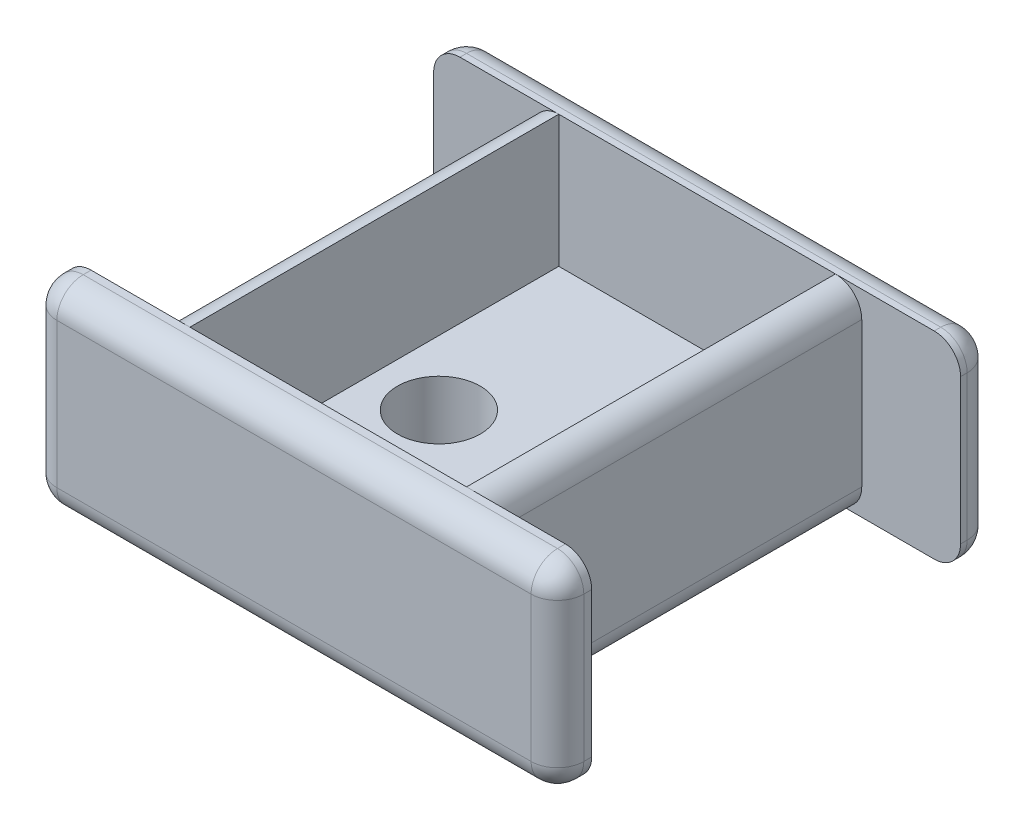
from build123d import *

# Parameters (mm, degrees)
BOSS_EXTRUDE1_DEPTH = 19.05
SKETCH4_R           = 4.064
SKETCH4_R_2         = 4.0005
CUT_EXTRUDE3_DEPTH  = 38.1
FILLET8_R           = 2.54
FILLET9_R           = 2.54
SKETCH9_W           = 26.67
SKETCH9_H           = 35.56
CUT_EXTRUDE6_DEPTH  = 12.7
BOSS_EXTRUDE2_DEPTH = 0.254


with BuildPart() as part:
    # Sketch1 → Boss-Extrude1 (new body)
    with BuildSketch(Plane(origin=(0, 0, 0), x_dir=(1, 0, 0), z_dir=(0, 1, 0))):
        Polygon((25.4, 20.955), (-25.4, 20.955), (-25.4, 17.78), (-15.875, 17.78), (-15.875, -17.78), (-25.4, -17.78), (-25.4, -21.082), (25.4, -21.082), (25.4, -17.78), (15.875, -17.78), (15.875, 17.78), (25.4, 17.78), align=None)
    extrude(amount=BOSS_EXTRUDE1_DEPTH)

    # Sketch4 → Cut-Extrude3 (cut)
    with BuildSketch(Plane(origin=(0, 19.05, 0), x_dir=(1, 0, 0), z_dir=(0, 1, 0))):
        with Locations(Location((6.985, 0, 0), (0, 0, 270))):
            Circle(SKETCH4_R)
        with Locations(Location((-7.112, 0, 0), (0, 0, 270))):
            Circle(SKETCH4_R_2)
    extrude(amount=-CUT_EXTRUDE3_DEPTH, mode=Mode.SUBTRACT)

    # Fillet8
    fillet8_edges = [part.edges().sort_by_distance(p)[0] for p in [
        (15.875, 0, 0),
        (0, 0, 21.082),
        (-15.875, 0, 0),
        (0, 0, -20.955),
        (-15.875, 19.05, 0),
        (0, 19.05, 21.082),
        (15.875, 19.05, 0),
        (0, 19.05, -20.955),
    ]]
    fillet(fillet8_edges, radius=FILLET8_R)

    # Fillet9
    fillet9_edges = [part.edges().sort_by_distance(p)[0] for p in [
        (-25.4, 0, 18.161),
        (25.4, 0, -18.0975),
        (-25.4, 19.05, 18.161),
        (25.4, 19.05, -18.0975),
        (-25.4, 9.525, -20.955),
        (25.4, 9.525, -20.955),
        (-25.4, 0, -18.0975),
        (-25.4, 19.05, -18.0975),
        (-25.4, 18.306051224, -20.211051224),
        (-25.4, 0.743948776, -20.211051224),
        (25.4, 0, 18.161),
        (25.4, 18.306051224, -20.211051224),
        (25.4, 0.743948776, -20.211051224),
        (25.4, 9.525, 21.082),
        (-25.4, 9.525, 21.082),
        (25.4, 19.05, 18.161),
        (25.4, 18.306051224, 20.338051224),
        (25.4, 0.743948776, 20.338051224),
        (-25.4, 18.306051224, 20.338051224),
        (-25.4, 0.743948776, 20.338051224),
    ]]
    fillet(fillet9_edges, radius=FILLET9_R)

    # Sketch9 → Cut-Extrude6 (cut)
    with BuildSketch(Plane(origin=(0, 19.05, 0), x_dir=(1, 0, 0), z_dir=(0, 1, 0))):
        Rectangle(SKETCH9_W, SKETCH9_H)
    extrude(amount=-CUT_EXTRUDE6_DEPTH, mode=Mode.SUBTRACT)

    # Sketch10 → Boss-Extrude2 (add)
    # profile 1 of 6: a face of its own
    with BuildSketch(Plane.ZY.offset(15.875)):
        with BuildLine():
            Line((-12.428218361, 9.878456619), (-12.428218361, 8.364943106))
            Line((-12.428218361, 8.364943106), (-12.208729341, 8.364943106))
            add(Edge.make_bspline(
                [(-12.208729341, 8.364943106), (-12.180616558, 8.365690265), (-12.125673568, 8.367150495), (-12.045658699, 8.377427278), (-11.970309821, 8.39514739), (-11.899982609, 8.420349213), (-11.834121009, 8.452287921), (-11.773429787, 8.491629768), (-11.717332866, 8.537958281), (-11.665938638, 8.591911368), (-11.618331766, 8.653794358), (-11.574984177, 8.724337959), (-11.534888519, 8.803496713), (-11.49830777, 8.891239191), (-11.464954173, 8.987736915), (-11.43597942, 9.092802925), (-11.408802352, 9.206306107), (-11.394885674, 9.285428621), (-11.387677821, 9.326408477)],
                knots=[0, 0, 0, 0, 0.962867631, 1.881806797, 2.75778512, 3.609196864, 4.435656485, 5.259527481, 6.080628282, 6.92211412, 7.806505393, 8.7501395, 9.753953683, 10.843121875, 12.003935138, 13.24877583, 14.575060796, 16, 16, 16, 16], degree=3))
            Line((-11.387677821, 9.326408477), (-11.300473429, 9.326408477))
            Line((-11.300473429, 9.326408477), (-11.300473429, 7.318490403))
            Line((-11.300473429, 7.318490403), (-11.392850963, 7.318490403))
            add(Edge.make_bspline(
                [(-11.392850963, 7.318490403), (-11.39934008, 7.359704496), (-11.411706859, 7.438249171), (-11.435525947, 7.548337221), (-11.460098596, 7.645587806), (-11.488669104, 7.730405829), (-11.520332587, 7.807052079), (-11.556424835, 7.878255468), (-11.598518009, 7.945075297), (-11.630935932, 7.986097142), (-11.647073936, 8.006518275)],
                knots=[0, 0, 0, 0, 1.347106059, 2.567277364, 3.636273155, 4.584709308, 5.454914307, 6.312371043, 7.159879461, 8, 8, 8, 8], degree=3))
            add(Edge.make_bspline(
                [(-11.647073936, 8.006518275), (-11.665269253, 8.027726126), (-11.70111357, 8.069505057), (-11.763799725, 8.122939975), (-11.831002075, 8.16938286), (-11.905054217, 8.206337121), (-11.984666097, 8.235214658), (-12.070123871, 8.256005672), (-12.161363743, 8.267532579), (-12.223971322, 8.269394963), (-12.256026638, 8.270348511)],
                knots=[0, 0, 0, 0, 0.973810499, 1.918382085, 2.864985682, 3.818434723, 4.797467574, 5.814959202, 6.881250899, 8, 8, 8, 8], degree=3))
            Line((-12.256026638, 8.270348511), (-12.428218361, 8.270348511))
            Line((-12.428218361, 8.270348511), (-12.428218361, 7.205420302))
            add(Edge.make_bspline(
                [(-12.428218361, 7.205420302), (-12.427873479, 7.179290217), (-12.427204981, 7.128641254), (-12.419767609, 7.055234451), (-12.407248462, 6.987042322), (-12.390202895, 6.924027973), (-12.369430061, 6.865753484), (-12.341274281, 6.813719758), (-12.309705217, 6.766148121), (-12.273199639, 6.723451461), (-12.231408506, 6.68623578), (-12.184450142, 6.65420593), (-12.132109903, 6.627730262), (-12.075033876, 6.605336217), (-12.012482597, 6.588708937), (-11.94532025, 6.576128196), (-11.872891507, 6.568628643), (-11.822978929, 6.567981439), (-11.797095051, 6.567645808)],
                knots=[0, 0, 0, 0, 1.214734356, 2.354567063, 3.426283889, 4.434989608, 5.388249835, 6.29523612, 7.178473649, 8.039518568, 8.899496045, 9.773248569, 10.674938643, 11.621568376, 12.619221065, 13.679675458, 14.796716187, 16, 16, 16, 16], degree=3))
            Line((-11.797095051, 6.567645808), (-11.574649949, 6.567645808))
            Line((-11.574649949, 6.567645808), (-11.574649949, 6.473051214))
            Line((-11.574649949, 6.473051214), (-13.906258902, 6.473051214))
            Line((-13.906258902, 6.473051214), (-13.906258902, 6.567645808))
            Line((-13.906258902, 6.567645808), (-13.81905451, 6.567645808))
            add(Edge.make_bspline(
                [(-13.81905451, 6.567645808), (-13.793173369, 6.568006712), (-13.742775841, 6.568709487), (-13.66982425, 6.575978311), (-13.601975281, 6.588838081), (-13.539112378, 6.605201611), (-13.481801021, 6.627706466), (-13.429388114, 6.654429138), (-13.381870839, 6.685991946), (-13.339975425, 6.723456967), (-13.303762429, 6.766078043), (-13.27144685, 6.813193171), (-13.244185502, 6.865462277), (-13.222781986, 6.923447654), (-13.205984384, 6.986321766), (-13.193476154, 7.054250407), (-13.185954816, 7.127406667), (-13.185309605, 7.177811597), (-13.184975118, 7.203942261)],
                knots=[0, 0, 0, 0, 1.201641854, 2.339919186, 3.39892652, 4.406255795, 5.35159379, 6.25205345, 7.134085744, 7.992889725, 8.852759693, 9.725319925, 10.641197808, 11.582443261, 12.589772536, 13.660026934, 14.786923228, 16, 16, 16, 16], degree=3))
            Line((-13.184975118, 7.203942261), (-13.184975118, 9.242160166))
            add(Edge.make_bspline(
                [(-13.184975118, 9.242160166), (-13.185342493, 9.268285674), (-13.186058036, 9.319170899), (-13.193243266, 9.392883187), (-13.206343648, 9.46108695), (-13.221537637, 9.524467047), (-13.244604502, 9.581724084), (-13.270521186, 9.634591019), (-13.302888777, 9.681391245), (-13.339228301, 9.723451269), (-13.381261436, 9.759897221), (-13.42819623, 9.791735284), (-13.479970566, 9.819453083), (-13.537841292, 9.840612349), (-13.600689392, 9.857454106), (-13.668864901, 9.870015399), (-13.742276501, 9.877440606), (-13.792924779, 9.878110841), (-13.81905451, 9.878456619)],
                knots=[0, 0, 0, 0, 1.211797835, 2.360245289, 3.429371327, 4.43271442, 5.377055753, 6.286743398, 7.158383697, 8.008714094, 8.859044491, 9.730684789, 10.635478509, 11.575731615, 12.581998871, 13.651124909, 14.788202165, 16, 16, 16, 16], degree=3))
            Line((-13.81905451, 9.878456619), (-13.906258902, 9.878456619))
            Line((-13.906258902, 9.878456619), (-13.906258902, 9.973051214))
            Line((-13.906258902, 9.973051214), (-10.07369978, 9.973051214))
            Line((-10.07369978, 9.973051214), (-10.07369978, 8.462493781))
            Line((-10.07369978, 8.462493781), (-10.15573103, 8.462493781))
            add(Edge.make_bspline(
                [(-10.15573103, 8.462493781), (-10.16815866, 8.524958031), (-10.192002131, 8.644801044), (-10.229503377, 8.78891403), (-10.259534232, 8.89335961), (-10.280445786, 8.961003624), (-10.30253496, 9.018620191), (-10.318405844, 9.053285184), (-10.325705693, 9.069229423)],
                knots=[0, 0, 0, 0, 1.815178137, 3.482574705, 4.242659767, 4.913343155, 5.500189807, 6, 6, 6, 6], degree=3))
            add(Edge.make_bspline(
                [(-10.325705693, 9.069229423), (-10.346997579, 9.113642936), (-10.388492147, 9.200197952), (-10.459793096, 9.32160666), (-10.540454033, 9.428866634), (-10.626249156, 9.525419995), (-10.720267531, 9.609592223), (-10.821892508, 9.682603282), (-10.932223194, 9.743367399), (-11.050406574, 9.79302267), (-11.17672221, 9.83151415), (-11.311395658, 9.858348987), (-11.454209315, 9.876092522), (-11.552423531, 9.877655831), (-11.60273272, 9.878456619)],
                knots=[0, 0, 0, 0, 1.098226841, 2.140272995, 3.133547444, 4.086628967, 5.01643607, 5.941818129, 6.871349284, 7.819239113, 8.795890279, 9.810821449, 10.878616558, 12, 12, 12, 12], degree=3))
            Line((-11.60273272, 9.878456619), (-12.428218361, 9.878456619))
        make_face()
    # profile 2 of 6: a face of its own
    with BuildSketch(Plane.ZY.offset(15.875)):
        with BuildLine():
            Line((-9.656153328, 9.973051214), (-7.224776638, 9.973051214))
            Line((-7.224776638, 9.973051214), (-7.224776638, 9.878456619))
            Line((-7.224776638, 9.878456619), (-7.498214138, 9.878456619))
            add(Edge.make_bspline(
                [(-7.498214138, 9.878456619), (-7.523604398, 9.878102746), (-7.573022414, 9.87741399), (-7.644723588, 9.870034668), (-7.711403067, 9.857413564), (-7.773171901, 9.840697366), (-7.829793136, 9.818578977), (-7.881067824, 9.790808976), (-7.928128014, 9.759200366), (-7.969894888, 9.721902653), (-8.006313743, 9.679179775), (-8.038325838, 9.631713892), (-8.06499476, 9.578792199), (-8.086250123, 9.520648235), (-8.103160652, 9.457566517), (-8.115784771, 9.389154752), (-8.123111909, 9.315484931), (-8.123807287, 9.264593671), (-8.124164307, 9.238465065)],
                knots=[0, 0, 0, 0, 1.183666125, 2.3038138, 3.355928178, 4.345281173, 5.283849776, 6.183219152, 7.059401939, 7.921771364, 8.785211201, 9.670905375, 10.585333788, 11.541245421, 12.552756763, 13.62745447, 14.781886972, 16, 16, 16, 16], degree=3))
            Line((-8.124164307, 9.238465065), (-8.124164307, 7.452992092))
            add(Edge.make_bspline(
                [(-8.124164307, 7.452992092), (-8.122508381, 7.403852208), (-8.119288557, 7.308303455), (-8.09299675, 7.170442357), (-8.049939934, 7.043225226), (-7.990167609, 6.926725372), (-7.911903741, 6.823415476), (-7.819811092, 6.731427526), (-7.711391854, 6.653360637), (-7.589071848, 6.587431266), (-7.452530739, 6.536065184), (-7.303471153, 6.499351019), (-7.142438544, 6.476955432), (-7.03098174, 6.474379485), (-6.973509747, 6.473051214)],
                knots=[0, 0, 0, 0, 1.034620493, 2.01174059, 2.943918765, 3.856135388, 4.757062871, 5.663474232, 6.588357472, 7.561278922, 8.582945766, 9.652823849, 10.789693508, 12, 12, 12, 12], degree=3))
            add(Edge.make_bspline(
                [(-6.973509747, 6.473051214), (-6.922228717, 6.474242328), (-6.820861165, 6.476596811), (-6.671717808, 6.493589883), (-6.527981799, 6.522830956), (-6.390828861, 6.562011965), (-6.262777946, 6.611770462), (-6.146976331, 6.670522707), (-6.044818485, 6.738513292), (-5.98654541, 6.792040934), (-5.958095895, 6.81817368)],
                knots=[0, 0, 0, 0, 1.120644207, 2.215184851, 3.275247005, 4.323140333, 5.328904462, 6.272763422, 7.156745323, 8, 8, 8, 8], degree=3))
            add(Edge.make_bspline(
                [(-5.958095895, 6.81817368), (-5.93453439, 6.844503413), (-5.887165344, 6.897437823), (-5.827601297, 6.986872942), (-5.776992926, 7.083796916), (-5.735739638, 7.188093239), (-5.703799525, 7.300262995), (-5.681419144, 7.420004096), (-5.666865154, 7.547475672), (-5.665437084, 7.634995806), (-5.664704848, 7.679871315)],
                knots=[0, 0, 0, 0, 0.907850671, 1.825181402, 2.754749982, 3.716017578, 4.704708414, 5.749775835, 6.846208846, 8, 8, 8, 8], degree=3))
            Line((-5.664704848, 7.679871315), (-5.664704848, 8.939161856))
            add(Edge.make_bspline(
                [(-5.664704848, 8.939161856), (-5.665561141, 8.987493258), (-5.667209174, 9.080512446), (-5.683534308, 9.214179293), (-5.71049035, 9.335855256), (-5.747995485, 9.445419985), (-5.796232733, 9.543379433), (-5.856468008, 9.628654361), (-5.926934611, 9.702932034), (-5.982242913, 9.741151728), (-6.009827314, 9.760213376)],
                knots=[0, 0, 0, 0, 1.245753361, 2.39759167, 3.465474722, 4.453792469, 5.376996215, 6.270462566, 7.137412406, 8, 8, 8, 8], degree=3))
            add(Edge.make_bspline(
                [(-6.009827314, 9.760213376), (-6.042740413, 9.779185873), (-6.108051792, 9.816834103), (-6.199819529, 9.846098779), (-6.280498449, 9.86049873), (-6.352823333, 9.868966029), (-6.437117787, 9.875740235), (-6.497319411, 9.877513103), (-6.529358564, 9.878456619)],
                knots=[0, 0, 0, 0, 1.263201928, 2.506645158, 3.182866477, 3.993341604, 4.932061436, 6, 6, 6, 6], degree=3))
            Line((-6.529358564, 9.878456619), (-6.529358564, 9.973051214))
            Line((-6.529358564, 9.973051214), (-4.839219206, 9.973051214))
            Line((-4.839219206, 9.973051214), (-4.839219206, 9.878456619))
            add(Edge.make_bspline(
                [(-4.839219206, 9.878456619), (-4.864125201, 9.876225863), (-4.911345879, 9.871996446), (-4.977953882, 9.862435697), (-5.03651438, 9.850868266), (-5.105041625, 9.832025402), (-5.187460207, 9.796705011), (-5.246820833, 9.756393995), (-5.278197247, 9.735086687)],
                knots=[0, 0, 0, 0, 0.959871685, 1.819874719, 2.582181741, 3.249919705, 4.546382294, 6, 6, 6, 6], degree=3))
            add(Edge.make_bspline(
                [(-5.278197247, 9.735086687), (-5.300915138, 9.71595603), (-5.346368149, 9.67768021), (-5.405301727, 9.609168491), (-5.45554419, 9.53170047), (-5.497916689, 9.4457621), (-5.53013796, 9.351009655), (-5.553764889, 9.248545956), (-5.56792733, 9.137861972), (-5.56936729, 9.061389125), (-5.570110253, 9.021932126)],
                knots=[0, 0, 0, 0, 0.891296972, 1.783269844, 2.703003498, 3.659672428, 4.65452199, 5.703075205, 6.814876632, 8, 8, 8, 8], degree=3))
            Line((-5.570110253, 9.021932126), (-5.570110253, 7.619271653))
            add(Edge.make_bspline(
                [(-5.570110253, 7.619271653), (-5.571181376, 7.573912582), (-5.573259127, 7.485925563), (-5.58708609, 7.35774874), (-5.611563393, 7.238144585), (-5.644583043, 7.126000571), (-5.688112713, 7.022312652), (-5.741825835, 6.927000056), (-5.804532009, 6.839385589), (-5.854205827, 6.788278207), (-5.879020726, 6.76274716)],
                knots=[0, 0, 0, 0, 1.162756437, 2.255501963, 3.299502036, 4.288422551, 5.247788254, 6.175176988, 7.088397021, 8, 8, 8, 8], degree=3))
            add(Edge.make_bspline(
                [(-5.879020726, 6.76274716), (-5.906335252, 6.737239544), (-5.959964985, 6.687157524), (-6.047760274, 6.624138426), (-6.137331428, 6.570240819), (-6.200384542, 6.543771096), (-6.231533395, 6.530694795)],
                knots=[0, 0, 0, 0, 1.054621979, 2.070659909, 3.046887177, 4, 4, 4, 4], degree=3))
            add(Edge.make_bspline(
                [(-6.231533395, 6.530694795), (-6.265153692, 6.518480726), (-6.333513973, 6.493645813), (-6.440254097, 6.46312609), (-6.551309914, 6.43612161), (-6.667492154, 6.416154847), (-6.787901557, 6.398559471), (-6.913486011, 6.387359607), (-7.043614695, 6.379451002), (-7.131893641, 6.378791602), (-7.176740321, 6.378456619)],
                knots=[0, 0, 0, 0, 0.891566565, 1.812825789, 2.766219052, 3.739639371, 4.75065812, 5.799366071, 6.88205363, 8, 8, 8, 8], degree=3))
            add(Edge.make_bspline(
                [(-7.176740321, 6.378456619), (-7.242786307, 6.379472639), (-7.371846056, 6.381458033), (-7.560658613, 6.396269394), (-7.740124577, 6.421236786), (-7.909358158, 6.456181073), (-8.06666209, 6.501114901), (-8.210724946, 6.554065638), (-8.341174421, 6.615428368), (-8.419494268, 6.6653722), (-8.457462449, 6.689584153)],
                knots=[0, 0, 0, 0, 1.185940103, 2.317432746, 3.398467779, 4.43782573, 5.41793926, 6.333323014, 7.192022255, 8, 8, 8, 8], degree=3))
            add(Edge.make_bspline(
                [(-8.457462449, 6.689584153), (-8.491090041, 6.713684858), (-8.557175992, 6.761048285), (-8.644203109, 6.84434083), (-8.717014539, 6.936266879), (-8.777791576, 7.034899263), (-8.823526917, 7.141953055), (-8.857058188, 7.255976178), (-8.877355584, 7.37812245), (-8.879711814, 7.462274512), (-8.880921064, 7.505462531)],
                knots=[0, 0, 0, 0, 1.032984291, 2.030051666, 2.998193363, 3.956835243, 4.916326676, 5.898092387, 6.921271509, 8, 8, 8, 8], degree=3))
            Line((-8.880921064, 7.505462531), (-8.880921064, 9.238465065))
            add(Edge.make_bspline(
                [(-8.880921064, 9.238465065), (-8.881262263, 9.264349693), (-8.881923436, 9.31450885), (-8.889405017, 9.387170097), (-8.901819532, 9.454957992), (-8.919617545, 9.517712994), (-8.941518831, 9.575905386), (-8.9690724, 9.628583437), (-9.001163971, 9.676504061), (-9.037918231, 9.719716571), (-9.080934915, 9.756873955), (-9.128198299, 9.789501082), (-9.180672341, 9.816942542), (-9.237783001, 9.839911751), (-9.299911096, 9.857784324), (-9.367169201, 9.868744393), (-9.438887473, 9.877794912), (-9.488609027, 9.878231417), (-9.514261436, 9.878456619)],
                knots=[0, 0, 0, 0, 1.202317824, 2.329848042, 3.389451109, 4.400397054, 5.356940965, 6.273334065, 7.155862536, 8.03235821, 8.900216767, 9.78917931, 10.695437472, 11.645522352, 12.645457828, 13.691747676, 14.809123437, 16, 16, 16, 16], degree=3))
            Line((-9.514261436, 9.878456619), (-9.656153328, 9.878456619))
            Line((-9.656153328, 9.878456619), (-9.656153328, 9.973051214))
        make_face()
    # profile 3 of 6: a face of its own
    with BuildSketch(Plane.ZY.offset(15.875)):
        with BuildLine():
            Line((-4.60273272, 9.973051214), (-0.491562956, 9.973051214))
            Line((-0.491562956, 9.973051214), (-0.491562956, 8.194229423))
            Line((-0.491562956, 8.194229423), (-0.571377145, 8.189056281))
            add(Edge.make_bspline(
                [(-0.571377145, 8.189056281), (-0.577394616, 8.243830212), (-0.589233865, 8.3515968), (-0.617681752, 8.509795506), (-0.654387198, 8.662161979), (-0.700271387, 8.808489626), (-0.754374647, 8.949052765), (-0.817245715, 9.083665282), (-0.888714791, 9.212719661), (-0.943257229, 9.294011532), (-0.970448091, 9.3345377)],
                knots=[0, 0, 0, 0, 1.077639742, 2.12023413, 3.141712916, 4.141502564, 5.117814788, 6.085755003, 7.045697765, 8, 8, 8, 8], degree=3))
            add(Edge.make_bspline(
                [(-0.970448091, 9.3345377), (-1.004036276, 9.377924379), (-1.069320184, 9.462253199), (-1.180169051, 9.573287671), (-1.296763202, 9.667841822), (-1.421002553, 9.744801568), (-1.551565251, 9.805516868), (-1.689728229, 9.847140934), (-1.834025091, 9.874417691), (-1.932772098, 9.87709656), (-1.982905861, 9.878456619)],
                knots=[0, 0, 0, 0, 1.100109691, 2.138235824, 3.140287537, 4.105980005, 5.063694346, 6.020604662, 6.995062822, 8, 8, 8, 8], degree=3))
            Line((-1.982905861, 9.878456619), (-2.164704848, 9.878456619))
            Line((-2.164704848, 9.878456619), (-2.164704848, 7.203942261))
            add(Edge.make_bspline(
                [(-2.164704848, 7.203942261), (-2.164350489, 7.178305947), (-2.16366062, 7.128396992), (-2.156282853, 7.055958403), (-2.143649063, 6.988548186), (-2.126974807, 6.926027108), (-2.104640528, 6.868535018), (-2.077234021, 6.816111408), (-2.045526652, 6.767851413), (-2.007418145, 6.726149352), (-1.965484634, 6.688165244), (-1.918096323, 6.655952857), (-1.866046468, 6.628429606), (-1.808964668, 6.606171449), (-1.74711553, 6.588572607), (-1.680077528, 6.576118072), (-1.608393493, 6.568674677), (-1.558973046, 6.567995011), (-1.533581537, 6.567645808)],
                knots=[0, 0, 0, 0, 1.196207752, 2.328785576, 3.39313216, 4.394446538, 5.344550691, 6.265046201, 7.151525482, 8.030893351, 8.894027207, 9.786969363, 10.697284563, 11.636685143, 12.641097023, 13.694144027, 14.815284637, 16, 16, 16, 16], degree=3))
            Line((-1.533581537, 6.567645808), (-1.007399105, 6.567645808))
            Line((-1.007399105, 6.567645808), (-1.007399105, 6.473051214))
            Line((-1.007399105, 6.473051214), (-4.076550287, 6.473051214))
            Line((-4.076550287, 6.473051214), (-4.076550287, 6.567645808))
            Line((-4.076550287, 6.567645808), (-3.554801976, 6.567645808))
            add(Edge.make_bspline(
                [(-3.554801976, 6.567645808), (-3.529163514, 6.567986739), (-3.479495513, 6.568647205), (-3.407570072, 6.576126502), (-3.340518198, 6.588543371), (-3.278496291, 6.60633579), (-3.221044122, 6.628255952), (-3.168770402, 6.655923367), (-3.121435242, 6.688445783), (-3.078726873, 6.725637743), (-3.041463537, 6.768153413), (-3.00963644, 6.816068969), (-2.982219159, 6.868531385), (-2.96013943, 6.926151654), (-2.942263776, 6.988409242), (-2.929961288, 7.055979928), (-2.922484602, 7.12839111), (-2.921808759, 7.178303951), (-2.921461605, 7.203942261)],
                knots=[0, 0, 0, 0, 1.194246268, 2.313548484, 3.364868753, 4.367633646, 5.316179863, 6.225002373, 7.116480325, 7.986794574, 8.857108824, 9.742134499, 10.661120625, 11.609666842, 12.612431735, 13.675033055, 14.805753732, 16, 16, 16, 16], degree=3))
            Line((-2.921461605, 7.203942261), (-2.921461605, 9.878456619))
            Line((-2.921461605, 9.878456619), (-3.146123767, 9.878456619))
            add(Edge.make_bspline(
                [(-3.146123767, 9.878456619), (-3.197012616, 9.876956601), (-3.297138111, 9.874005265), (-3.443156149, 9.844552575), (-3.58184127, 9.798747495), (-3.7135193, 9.734402959), (-3.83756068, 9.651068604), (-3.953043252, 9.548154255), (-4.062992066, 9.429105785), (-4.126136207, 9.338321949), (-4.158581537, 9.291674525)],
                knots=[0, 0, 0, 0, 0.997412868, 1.962442805, 2.910127415, 3.856973432, 4.828914921, 5.832457869, 6.886252656, 8, 8, 8, 8], degree=3))
            add(Edge.make_bspline(
                [(-4.158581537, 9.291674525), (-4.189624817, 9.241973769), (-4.25297096, 9.140555646), (-4.331128055, 8.974494896), (-4.399045212, 8.79541151), (-4.433086212, 8.669509903), (-4.450494544, 8.605124693)],
                knots=[0, 0, 0, 0, 0.93749145, 1.913021675, 2.932733735, 4, 4, 4, 4], degree=3))
            add(Edge.make_bspline(
                [(-4.450494544, 8.605124693), (-4.456119275, 8.579792322), (-4.468627379, 8.523458975), (-4.484255892, 8.429427491), (-4.500530485, 8.317816617), (-4.510293766, 8.237363946), (-4.515528328, 8.194229423)],
                knots=[0, 0, 0, 0, 0.748052937, 1.663497098, 2.747289114, 4, 4, 4, 4], degree=3))
            Line((-4.515528328, 8.194229423), (-4.60273272, 8.194229423))
            Line((-4.60273272, 8.194229423), (-4.60273272, 9.973051214))
        make_face()
    # profile 4 of 6: a face of its own
    with BuildSketch(Plane.ZY.offset(15.875)):
        with BuildLine():
            Line((-0.054801976, 9.973051214), (2.376574713, 9.973051214))
            Line((2.376574713, 9.973051214), (2.376574713, 9.878456619))
            Line((2.376574713, 9.878456619), (2.103137213, 9.878456619))
            add(Edge.make_bspline(
                [(2.103137213, 9.878456619), (2.077746953, 9.878102746), (2.028328938, 9.87741399), (1.956627763, 9.870034668), (1.889948285, 9.857413564), (1.82817945, 9.840697366), (1.771558215, 9.818578977), (1.720283528, 9.790808976), (1.673223338, 9.759200366), (1.631456464, 9.721902653), (1.595037608, 9.679179775), (1.563025514, 9.631713892), (1.536356592, 9.578792199), (1.515101229, 9.520648235), (1.498190699, 9.457566517), (1.48556658, 9.389154752), (1.478239442, 9.315484931), (1.477544065, 9.264593671), (1.477187044, 9.238465065)],
                knots=[0, 0, 0, 0, 1.183666125, 2.3038138, 3.355928178, 4.345281173, 5.283849776, 6.183219152, 7.059401939, 7.921771364, 8.785211201, 9.670905375, 10.585333788, 11.541245421, 12.552756763, 13.62745447, 14.781886972, 16, 16, 16, 16], degree=3))
            Line((1.477187044, 9.238465065), (1.477187044, 7.452992092))
            add(Edge.make_bspline(
                [(1.477187044, 7.452992092), (1.478842971, 7.403852208), (1.482062794, 7.308303455), (1.508354601, 7.170442357), (1.551411417, 7.043225226), (1.611183742, 6.926725372), (1.689447611, 6.823415476), (1.781540259, 6.731427526), (1.889959497, 6.653360637), (2.012279504, 6.587431266), (2.148820612, 6.536065184), (2.297880198, 6.499351019), (2.458912808, 6.476955432), (2.570369611, 6.474379485), (2.627841605, 6.473051214)],
                knots=[0, 0, 0, 0, 1.034620493, 2.01174059, 2.943918765, 3.856135388, 4.757062871, 5.663474232, 6.588357472, 7.561278922, 8.582945766, 9.652823849, 10.789693508, 12, 12, 12, 12], degree=3))
            add(Edge.make_bspline(
                [(2.627841605, 6.473051214), (2.679122634, 6.474242328), (2.780490187, 6.476596811), (2.929633544, 6.493589883), (3.073369552, 6.522830956), (3.21052249, 6.562011965), (3.338573405, 6.611770462), (3.454375021, 6.670522707), (3.556532867, 6.738513292), (3.614805941, 6.792040934), (3.643255456, 6.81817368)],
                knots=[0, 0, 0, 0, 1.120644207, 2.215184851, 3.275247005, 4.323140333, 5.328904462, 6.272763422, 7.156745323, 8, 8, 8, 8], degree=3))
            add(Edge.make_bspline(
                [(3.643255456, 6.81817368), (3.666816961, 6.844503413), (3.714186007, 6.897437823), (3.773750054, 6.986872942), (3.824358425, 7.083796916), (3.865611713, 7.188093239), (3.897551826, 7.300262995), (3.919932208, 7.420004096), (3.934486197, 7.547475672), (3.935914268, 7.634995806), (3.936646503, 7.679871315)],
                knots=[0, 0, 0, 0, 0.907850671, 1.825181402, 2.754749982, 3.716017578, 4.704708414, 5.749775835, 6.846208846, 8, 8, 8, 8], degree=3))
            Line((3.936646503, 7.679871315), (3.936646503, 8.939161856))
            add(Edge.make_bspline(
                [(3.936646503, 8.939161856), (3.93579021, 8.987493258), (3.934142178, 9.080512446), (3.917817043, 9.214179293), (3.890861002, 9.335855256), (3.853355867, 9.445419985), (3.805118618, 9.543379433), (3.744883344, 9.628654361), (3.67441674, 9.702932034), (3.619108439, 9.741151728), (3.591524037, 9.760213376)],
                knots=[0, 0, 0, 0, 1.245753361, 2.39759167, 3.465474722, 4.453792469, 5.376996215, 6.270462566, 7.137412406, 8, 8, 8, 8], degree=3))
            add(Edge.make_bspline(
                [(3.591524037, 9.760213376), (3.558610938, 9.779185873), (3.493299559, 9.816834103), (3.401531822, 9.846098779), (3.320852902, 9.86049873), (3.248528018, 9.868966029), (3.164233564, 9.875740235), (3.10403194, 9.877513103), (3.071992787, 9.878456619)],
                knots=[0, 0, 0, 0, 1.263201928, 2.506645158, 3.182866477, 3.993341604, 4.932061436, 6, 6, 6, 6], degree=3))
            Line((3.071992787, 9.878456619), (3.071992787, 9.973051214))
            Line((3.071992787, 9.973051214), (4.762132145, 9.973051214))
            Line((4.762132145, 9.973051214), (4.762132145, 9.878456619))
            add(Edge.make_bspline(
                [(4.762132145, 9.878456619), (4.73722615, 9.876225863), (4.690005472, 9.871996446), (4.623397469, 9.862435697), (4.564836971, 9.850868266), (4.496309726, 9.832025402), (4.413891145, 9.796705011), (4.354530518, 9.756393995), (4.323154105, 9.735086687)],
                knots=[0, 0, 0, 0, 0.959871685, 1.819874719, 2.582181741, 3.249919705, 4.546382294, 6, 6, 6, 6], degree=3))
            add(Edge.make_bspline(
                [(4.323154105, 9.735086687), (4.300436213, 9.71595603), (4.254983202, 9.67768021), (4.196049624, 9.609168491), (4.145807161, 9.53170047), (4.103434663, 9.4457621), (4.071213391, 9.351009655), (4.047586463, 9.248545956), (4.033424021, 9.137861972), (4.031984061, 9.061389125), (4.031241098, 9.021932126)],
                knots=[0, 0, 0, 0, 0.891296972, 1.783269844, 2.703003498, 3.659672428, 4.65452199, 5.703075205, 6.814876632, 8, 8, 8, 8], degree=3))
            Line((4.031241098, 9.021932126), (4.031241098, 7.619271653))
            add(Edge.make_bspline(
                [(4.031241098, 7.619271653), (4.030169976, 7.573912582), (4.028092225, 7.485925563), (4.014265261, 7.35774874), (3.989787959, 7.238144585), (3.956768309, 7.126000571), (3.913238638, 7.022312652), (3.859525517, 6.927000056), (3.796819342, 6.839385589), (3.747145525, 6.788278207), (3.722330625, 6.76274716)],
                knots=[0, 0, 0, 0, 1.162756437, 2.255501963, 3.299502036, 4.288422551, 5.247788254, 6.175176988, 7.088397021, 8, 8, 8, 8], degree=3))
            add(Edge.make_bspline(
                [(3.722330625, 6.76274716), (3.695016099, 6.737239544), (3.641386367, 6.687157524), (3.553591077, 6.624138426), (3.464019923, 6.570240819), (3.400966809, 6.543771096), (3.369817956, 6.530694795)],
                knots=[0, 0, 0, 0, 1.054621979, 2.070659909, 3.046887177, 4, 4, 4, 4], degree=3))
            add(Edge.make_bspline(
                [(3.369817956, 6.530694795), (3.336197659, 6.518480726), (3.267837378, 6.493645813), (3.161097254, 6.46312609), (3.050041437, 6.43612161), (2.933859197, 6.416154847), (2.813449794, 6.398559471), (2.687865341, 6.387359607), (2.557736656, 6.379451002), (2.469457711, 6.378791602), (2.42461103, 6.378456619)],
                knots=[0, 0, 0, 0, 0.891566565, 1.812825789, 2.766219052, 3.739639371, 4.75065812, 5.799366071, 6.88205363, 8, 8, 8, 8], degree=3))
            add(Edge.make_bspline(
                [(2.42461103, 6.378456619), (2.358565044, 6.379472639), (2.229505295, 6.381458033), (2.040692738, 6.396269394), (1.861226774, 6.421236786), (1.691993193, 6.456181073), (1.534689261, 6.501114901), (1.390626405, 6.554065638), (1.26017693, 6.615428368), (1.181857083, 6.6653722), (1.143888902, 6.689584153)],
                knots=[0, 0, 0, 0, 1.185940103, 2.317432746, 3.398467779, 4.43782573, 5.41793926, 6.333323014, 7.192022255, 8, 8, 8, 8], degree=3))
            add(Edge.make_bspline(
                [(1.143888902, 6.689584153), (1.11026131, 6.713684858), (1.044175359, 6.761048285), (0.957148242, 6.84434083), (0.884336812, 6.936266879), (0.823559776, 7.034899263), (0.777824435, 7.141953055), (0.744293163, 7.255976178), (0.723995767, 7.37812245), (0.721639538, 7.462274512), (0.720430287, 7.505462531)],
                knots=[0, 0, 0, 0, 1.032984291, 2.030051666, 2.998193363, 3.956835243, 4.916326676, 5.898092387, 6.921271509, 8, 8, 8, 8], degree=3))
            Line((0.720430287, 7.505462531), (0.720430287, 9.238465065))
            add(Edge.make_bspline(
                [(0.720430287, 9.238465065), (0.720089089, 9.264349693), (0.719427915, 9.31450885), (0.711946335, 9.387170097), (0.699531819, 9.454957992), (0.681733806, 9.517712994), (0.65983252, 9.575905386), (0.632278951, 9.628583437), (0.60018738, 9.676504061), (0.56343312, 9.719716571), (0.520416436, 9.756873955), (0.473153052, 9.789501082), (0.42067901, 9.816942542), (0.363568351, 9.839911751), (0.301440256, 9.857784324), (0.234182151, 9.868744393), (0.162463879, 9.877794912), (0.112742325, 9.878231417), (0.087089916, 9.878456619)],
                knots=[0, 0, 0, 0, 1.202317824, 2.329848042, 3.389451109, 4.400397054, 5.356940965, 6.273334065, 7.155862536, 8.03235821, 8.900216767, 9.78917931, 10.695437472, 11.645522352, 12.645457828, 13.691747676, 14.809123437, 16, 16, 16, 16], degree=3))
            Line((0.087089916, 9.878456619), (-0.054801976, 9.878456619))
            Line((-0.054801976, 9.878456619), (-0.054801976, 9.973051214))
        make_face()
    # profile 5 of 6: a face of its own
    with BuildSketch(Plane.ZY.offset(15.875)):
        with BuildLine():
            Line((7.374568801, 8.175753916), (6.585295152, 8.175753916))
            Line((6.585295152, 8.175753916), (6.585295152, 7.20098618))
            add(Edge.make_bspline(
                [(6.585295152, 7.20098618), (6.58562387, 7.175100492), (6.586257746, 7.125184425), (6.593850224, 7.05278001), (6.606118797, 6.985467453), (6.623884529, 6.923145166), (6.646322148, 6.865855468), (6.672234159, 6.812749297), (6.705688853, 6.766114821), (6.74248827, 6.723386117), (6.785105215, 6.686232264), (6.832776642, 6.654195723), (6.885856552, 6.627734912), (6.943663916, 6.605326848), (7.006723646, 6.58881866), (7.074580112, 6.575984032), (7.147529528, 6.568707919), (7.197927366, 6.568006179), (7.223808666, 6.567645808)],
                knots=[0, 0, 0, 0, 1.201621739, 2.317119521, 3.376109128, 4.375465689, 5.320787859, 6.231420348, 7.110465611, 7.97782172, 8.845177828, 9.727195358, 10.637827846, 11.593817963, 12.601130375, 13.660119983, 14.798378261, 16, 16, 16, 16], degree=3))
            Line((7.223808666, 6.567645808), (7.327271503, 6.567645808))
            Line((7.327271503, 6.567645808), (7.327271503, 6.473051214))
            Line((7.327271503, 6.473051214), (5.100603429, 6.473051214))
            Line((5.100603429, 6.473051214), (5.100603429, 6.567645808))
            Line((5.100603429, 6.567645808), (5.195198024, 6.567645808))
            add(Edge.make_bspline(
                [(5.195198024, 6.567645808), (5.221079104, 6.568006802), (5.271476513, 6.568709754), (5.344428939, 6.575977338), (5.412275026, 6.588841385), (5.475147834, 6.60519022), (5.532425296, 6.627745356), (5.5847741, 6.65420035), (5.631717667, 6.686243518), (5.673558757, 6.723426304), (5.709745462, 6.766086385), (5.742068261, 6.8131908), (5.769327563, 6.865462944), (5.790731659, 6.923447459), (5.807529091, 6.986321824), (5.820037371, 7.05425039), (5.827558695, 7.127406671), (5.828203907, 7.177811599), (5.828538395, 7.203942261)],
                knots=[0, 0, 0, 0, 1.202353652, 2.341305248, 3.40093989, 4.408865861, 5.354763831, 6.255756882, 7.128833979, 7.988146677, 8.848525993, 9.721603089, 10.638023497, 11.579826501, 12.587752472, 13.65864084, 14.786204657, 16, 16, 16, 16], degree=3))
            Line((5.828538395, 7.203942261), (5.828538395, 9.242160166))
            add(Edge.make_bspline(
                [(5.828538395, 9.242160166), (5.828204874, 9.268292446), (5.827555268, 9.31919086), (5.81991054, 9.392767029), (5.808405526, 9.461309632), (5.791687157, 9.524324263), (5.76903744, 9.581779124), (5.742844291, 9.634333771), (5.711462769, 9.681621601), (5.674973931, 9.723417824), (5.633004934, 9.759906421), (5.586052404, 9.791732691), (5.534283073, 9.819453817), (5.476410918, 9.840612133), (5.413563237, 9.857454169), (5.345387605, 9.87001538), (5.271976041, 9.877440612), (5.221327757, 9.878110843), (5.195198024, 9.878456619)],
                knots=[0, 0, 0, 0, 1.212213306, 2.361054512, 3.428529135, 4.435141395, 5.3798065, 6.289806035, 7.155352303, 8.00597424, 8.856596177, 9.728535322, 10.633639255, 11.574214732, 12.580826992, 13.650319585, 14.787786694, 16, 16, 16, 16], degree=3))
            Line((5.195198024, 9.878456619), (5.100603429, 9.878456619))
            Line((5.100603429, 9.878456619), (5.100603429, 9.973051214))
            Line((5.100603429, 9.973051214), (7.812807821, 9.973051214))
            add(Edge.make_bspline(
                [(7.812807821, 9.973051214), (7.857644579, 9.972732653), (7.944869877, 9.972112926), (8.072003668, 9.96832684), (8.192029702, 9.962677753), (8.304682996, 9.95400599), (8.410128833, 9.942021407), (8.508460192, 9.928009939), (8.599844107, 9.912300351), (8.70968063, 9.88684275), (8.835833762, 9.848821667), (8.972520098, 9.787131266), (9.094572305, 9.713054023), (9.162214808, 9.650068061), (9.195514747, 9.619060504)],
                knots=[0, 0, 0, 0, 1.1026507, 2.145093463, 3.127710445, 4.057454617, 4.923156212, 5.737071024, 6.500013756, 7.202472385, 8.509293697, 9.732155867, 10.883555914, 12, 12, 12, 12], degree=3))
            add(Edge.make_bspline(
                [(9.195514747, 9.619060504), (9.212437475, 9.600684338), (9.246602219, 9.563585298), (9.290420999, 9.50125909), (9.329240725, 9.434219252), (9.361836576, 9.363036831), (9.389560072, 9.289932532), (9.408396067, 9.215768336), (9.421193098, 9.142096972), (9.422488868, 9.092930721), (9.42313299, 9.068490403)],
                knots=[0, 0, 0, 0, 0.982726558, 1.983994524, 2.992191763, 4.029367408, 5.063590783, 6.065797937, 7.038517031, 8, 8, 8, 8], degree=3))
            add(Edge.make_bspline(
                [(9.42313299, 9.068490403), (9.422166576, 9.03611435), (9.420260026, 8.972242585), (9.400032448, 8.879300706), (9.368981047, 8.791254868), (9.325555025, 8.707883535), (9.26874134, 8.630228657), (9.199783331, 8.557300258), (9.118952499, 8.488717521), (9.057817241, 8.44947968), (9.026279105, 8.429237869)],
                knots=[0, 0, 0, 0, 0.983034381, 1.939338918, 2.877490213, 3.815551803, 4.786411914, 5.793214062, 6.861574848, 8, 8, 8, 8], degree=3))
            add(Edge.make_bspline(
                [(9.026279105, 8.429237869), (8.999150114, 8.415222612), (8.941358565, 8.385366602), (8.844774462, 8.34797645), (8.735037606, 8.311653449), (8.571688979, 8.26736787), (8.358774234, 8.221234173), (8.184997118, 8.201206495), (8.098808666, 8.191273342)],
                knots=[0, 0, 0, 0, 0.570533791, 1.215379956, 1.933391765, 2.731167072, 4.378752872, 6, 6, 6, 6], degree=3))
            add(Edge.make_bspline(
                [(8.098808666, 8.191273342), (8.081077255, 8.189956819), (8.04366706, 8.187179185), (7.984262013, 8.184571898), (7.918509923, 8.181354973), (7.846073981, 8.179223947), (7.766988312, 8.177994191), (7.681268561, 8.176270253), (7.589131968, 8.175610899), (7.525575264, 8.175705269), (7.492812044, 8.175753916)],
                knots=[0, 0, 0, 0, 0.703745394, 1.484780516, 2.353474026, 3.309495962, 4.35300933, 5.484265384, 6.703149161, 8, 8, 8, 8], degree=3))
            Line((7.492812044, 8.175753916), (7.492812044, 8.166146653))
            add(Edge.make_bspline(
                [(7.492812044, 8.166146653), (7.525522829, 8.145371291), (7.588939759, 8.105093761), (7.682000835, 8.047891955), (7.770696471, 7.996836561), (7.882127882, 7.937027464), (8.019292801, 7.872470616), (8.158331958, 7.816468274), (8.273098862, 7.777670048), (8.365087325, 7.751592684), (8.462286102, 7.725457738), (8.529359381, 7.709963681), (8.563652416, 7.702041923)],
                knots=[0, 0, 0, 0, 0.989780157, 1.918902832, 2.789874643, 3.60340579, 5.148610692, 6.659367881, 7.429397497, 8.241832945, 9.10108937, 10, 10, 10, 10], degree=3))
            Line((8.563652416, 7.702041923), (8.645683666, 7.577147498))
            add(Edge.make_bspline(
                [(8.645683666, 7.577147498), (8.658358691, 7.558499358), (8.681942478, 7.523801694), (8.713094681, 7.474534699), (8.741281018, 7.434270348), (8.770141865, 7.387025533), (8.807966021, 7.330521935), (8.838097781, 7.285002164), (8.854087382, 7.260846822)],
                knots=[0, 0, 0, 0, 1.071377605, 1.993458873, 2.769399216, 3.405936679, 4.623444599, 6, 6, 6, 6], degree=3))
            add(Edge.make_bspline(
                [(8.854087382, 7.260846822), (8.876366131, 7.226513568), (8.919585133, 7.159909786), (8.984876522, 7.064310795), (9.048030252, 6.975523224), (9.109991362, 6.895177282), (9.166814558, 6.822777008), (9.221463578, 6.763647287), (9.267929738, 6.71333065), (9.29994727, 6.686841309), (9.31449701, 6.674803748)],
                knots=[0, 0, 0, 0, 1.313652749, 2.548381848, 3.715725439, 4.810091755, 5.805397304, 6.667583828, 7.394509569, 8, 8, 8, 8], degree=3))
            add(Edge.make_bspline(
                [(9.31449701, 6.674803748), (9.328344137, 6.666068705), (9.356850735, 6.648086178), (9.404465383, 6.627470278), (9.455732709, 6.608743405), (9.51128117, 6.593223224), (9.571330621, 6.581457516), (9.635570017, 6.573767261), (9.704109167, 6.568178737), (9.751245371, 6.567827584), (9.775645659, 6.567645808)],
                knots=[0, 0, 0, 0, 0.817553247, 1.68306836, 2.58708467, 3.546472698, 4.56351669, 5.643721884, 6.780261055, 8, 8, 8, 8], degree=3))
            Line((9.775645659, 6.567645808), (9.872457314, 6.567645808))
            Line((9.872457314, 6.567645808), (9.872457314, 6.473051214))
            Line((9.872457314, 6.473051214), (8.588779105, 6.473051214))
            Line((8.588779105, 6.473051214), (7.374568801, 8.175753916))
        make_face()
        with BuildLine():
            Line((6.585295152, 8.270348511), (7.585928598, 8.270348511))
            add(Edge.make_bspline(
                [(7.585928598, 8.270348511), (7.642380444, 8.271199214), (7.750369268, 8.272826554), (7.904457803, 8.28889955), (8.042564062, 8.315888092), (8.165568853, 8.352984539), (8.273232548, 8.402862163), (8.366891658, 8.463520001), (8.44590774, 8.53605188), (8.50985829, 8.620795712), (8.560106409, 8.717309815), (8.593993177, 8.826974362), (8.616158944, 8.948368261), (8.618078469, 9.033648908), (8.619078936, 9.078097666)],
                knots=[0, 0, 0, 0, 1.350300784, 2.58304035, 3.700758403, 4.712992955, 5.649061865, 6.530153912, 7.372652008, 8.201327671, 9.058053739, 9.96203005, 10.937798454, 12, 12, 12, 12], degree=3))
            add(Edge.make_bspline(
                [(8.619078936, 9.078097666), (8.618575892, 9.110422837), (8.617596381, 9.173365345), (8.604083742, 9.264233679), (8.5857096, 9.34952073), (8.557470746, 9.428199995), (8.520808824, 9.5003888), (8.477302723, 9.566921478), (8.424773924, 9.626229243), (8.365121628, 9.680275278), (8.296851442, 9.727275176), (8.220824108, 9.768273755), (8.136620788, 9.802017522), (8.04461229, 9.829962437), (7.944818473, 9.852116025), (7.837069117, 9.867141588), (7.72160436, 9.877127077), (7.641870462, 9.878003948), (7.600709003, 9.878456619)],
                knots=[0, 0, 0, 0, 1.04759633, 2.039845137, 2.974223105, 3.874064963, 4.742488356, 5.595779195, 6.445244775, 7.305318815, 8.200892624, 9.126929757, 10.101876705, 11.138257986, 12.24337251, 13.414170929, 14.66510355, 16, 16, 16, 16], degree=3))
            Line((7.600709003, 9.878456619), (6.585295152, 9.878456619))
            Line((6.585295152, 9.878456619), (6.585295152, 8.270348511))
        make_face(mode=Mode.SUBTRACT)
    # profile 6 of 6: a face of its own
    with BuildSketch(Plane.ZY.offset(15.875)):
        with BuildLine():
            Line((10.114116943, 9.973051214), (13.840996166, 9.973051214))
            Line((13.840996166, 9.973051214), (13.840996166, 8.62212216))
            Line((13.840996166, 8.62212216), (13.766355118, 8.62212216))
            add(Edge.make_bspline(
                [(13.766355118, 8.62212216), (13.749852216, 8.677378782), (13.718880952, 8.781079784), (13.67193341, 8.924872732), (13.628012842, 9.046672036), (13.584963463, 9.149256379), (13.539284576, 9.239340336), (13.490247178, 9.324097903), (13.434257633, 9.406233283), (13.392753628, 9.458213737), (13.371718294, 9.484558815)],
                knots=[0, 0, 0, 0, 1.447635074, 2.716800271, 3.796716971, 4.69722576, 5.507540922, 6.330592663, 7.153899913, 8, 8, 8, 8], degree=3))
            add(Edge.make_bspline(
                [(13.371718294, 9.484558815), (13.345701257, 9.513955258), (13.295028646, 9.57120984), (13.211194984, 9.645330513), (13.123642037, 9.706665278), (13.061042267, 9.736626879), (13.030290929, 9.751345133)],
                knots=[0, 0, 0, 0, 1.076868837, 2.097385523, 3.065364924, 4, 4, 4, 4], degree=3))
            add(Edge.make_bspline(
                [(13.030290929, 9.751345133), (13.004042941, 9.761512207), (12.950832548, 9.782123083), (12.867797447, 9.807603736), (12.780888086, 9.830282364), (12.689437564, 9.847400317), (12.59408552, 9.861770434), (12.494644771, 9.871000305), (12.391114652, 9.877105428), (12.320594347, 9.878000177), (12.284619476, 9.878456619)],
                knots=[0, 0, 0, 0, 0.887292397, 1.798735042, 2.736925273, 3.717963014, 4.73077341, 5.776497595, 6.865713758, 8, 8, 8, 8], degree=3))
            Line((12.284619476, 9.878456619), (11.598808666, 9.878456619))
            Line((11.598808666, 9.878456619), (11.598808666, 8.223051214))
            Line((11.598808666, 8.223051214), (11.782824713, 8.223051214))
            add(Edge.make_bspline(
                [(11.782824713, 8.223051214), (11.816417492, 8.22383246), (11.882090898, 8.225359787), (11.977677735, 8.24361073), (12.068542814, 8.270085576), (12.153328946, 8.310235515), (12.233199236, 8.360025338), (12.307731835, 8.421108478), (12.375890783, 8.494353013), (12.416204236, 8.54902985), (12.436857652, 8.577041923)],
                knots=[0, 0, 0, 0, 1.036941302, 2.027205501, 2.997955775, 3.955233612, 4.916530786, 5.901246421, 6.924765152, 8, 8, 8, 8], degree=3))
            add(Edge.make_bspline(
                [(12.436857652, 8.577041923), (12.457083707, 8.60839275), (12.498183103, 8.672097712), (12.546504111, 8.777530989), (12.589788783, 8.890301393), (12.61032827, 8.969952283), (12.620873699, 9.010846822)],
                knots=[0, 0, 0, 0, 0.943942363, 1.918093296, 2.931102794, 4, 4, 4, 4], degree=3))
            add(Edge.make_bspline(
                [(12.620873699, 9.010846822), (12.626035187, 9.030748389), (12.637432998, 9.074695856), (12.650436395, 9.147688183), (12.665178742, 9.233006992), (12.67242421, 9.29433805), (12.67630022, 9.327147498)],
                knots=[0, 0, 0, 0, 0.767407356, 1.694620835, 2.766722441, 4, 4, 4, 4], degree=3))
            Line((12.67630022, 9.327147498), (12.763504612, 9.327147498))
            Line((12.763504612, 9.327147498), (12.763504612, 7.031750538))
            Line((12.763504612, 7.031750538), (12.67630022, 7.031750538))
            add(Edge.make_bspline(
                [(12.67630022, 7.031750538), (12.665783752, 7.09172753), (12.645315802, 7.208459311), (12.612244706, 7.350175301), (12.585538878, 7.456148571), (12.5620444, 7.526352374), (12.539096117, 7.589402471), (12.504571423, 7.663648688), (12.454509847, 7.75206069), (12.406287236, 7.817561798), (12.381431132, 7.851324018)],
                knots=[0, 0, 0, 0, 1.657533368, 3.22601746, 3.961354312, 4.631593595, 5.240758324, 5.786964186, 6.859301734, 8, 8, 8, 8], degree=3))
            add(Edge.make_bspline(
                [(12.381431132, 7.851324018), (12.362270667, 7.873538164), (12.324377163, 7.917470912), (12.258227833, 7.973665479), (12.187445135, 8.022148836), (12.109795756, 8.061099763), (12.026292862, 8.090888351), (11.937068595, 8.113562754), (11.841794811, 8.125806897), (11.776452154, 8.127557957), (11.742917618, 8.128456619)],
                knots=[0, 0, 0, 0, 0.975144931, 1.928536682, 2.879138924, 3.825203998, 4.810840928, 5.825052962, 6.883794419, 8, 8, 8, 8], degree=3))
            Line((11.742917618, 8.128456619), (11.598808666, 8.128456619))
            Line((11.598808666, 8.128456619), (11.598808666, 6.567645808))
            Line((11.598808666, 6.567645808), (12.172288395, 6.567645808))
            add(Edge.make_bspline(
                [(12.172288395, 6.567645808), (12.213679939, 6.568075796), (12.294302075, 6.568913322), (12.411978108, 6.575275402), (12.523083138, 6.587562081), (12.628312663, 6.602470426), (12.727793577, 6.623211254), (12.821715406, 6.649229018), (12.910813912, 6.679220943), (12.994867014, 6.715159143), (13.075638337, 6.755934604), (13.152792036, 6.803489878), (13.228138416, 6.855933568), (13.275422799, 6.89517454), (13.299294307, 6.914985335)],
                knots=[0, 0, 0, 0, 1.234440084, 2.404433048, 3.512687447, 4.567263271, 5.572981436, 6.540794094, 7.47243388, 8.374402339, 9.264807393, 10.168210871, 11.075221716, 12, 12, 12, 12], degree=3))
            add(Edge.make_bspline(
                [(13.299294307, 6.914985335), (13.338654174, 6.950785045), (13.41740054, 7.022408687), (13.519144178, 7.146620722), (13.608765933, 7.282440783), (13.654980301, 7.381391134), (13.678411706, 7.431560504)],
                knots=[0, 0, 0, 0, 0.986861948, 1.974391658, 2.972984996, 4, 4, 4, 4], degree=3))
            add(Edge.make_bspline(
                [(13.678411706, 7.431560504), (13.69167905, 7.463746985), (13.720034112, 7.532536159), (13.760796095, 7.644516265), (13.800814207, 7.77255256), (13.827129724, 7.863343938), (13.840996166, 7.91118466)],
                knots=[0, 0, 0, 0, 0.824292771, 1.761684315, 2.820563783, 4, 4, 4, 4], degree=3))
            Line((13.840996166, 7.91118466), (13.933373699, 7.91118466))
            Line((13.933373699, 7.91118466), (13.933373699, 6.473051214))
            Line((13.933373699, 6.473051214), (10.118551064, 6.473051214))
            Line((10.118551064, 6.473051214), (10.114116943, 6.567645808))
            Line((10.114116943, 6.567645808), (10.208711537, 6.567645808))
            add(Edge.make_bspline(
                [(10.208711537, 6.567645808), (10.234363978, 6.567870977), (10.284085593, 6.568307418), (10.355803438, 6.577358386), (10.423063022, 6.588316899), (10.485185986, 6.606194871), (10.542314436, 6.629145361), (10.5947261, 6.656652456), (10.642349356, 6.689135652), (10.684510271, 6.727164978), (10.722343062, 6.769666296), (10.753614813, 6.818213779), (10.781524584, 6.87089255), (10.803186342, 6.928936262), (10.821388559, 6.991577481), (10.833459477, 7.059448533), (10.841072551, 7.132327527), (10.841718544, 7.182490029), (10.842051909, 7.208376383)],
                knots=[0, 0, 0, 0, 1.190227921, 2.306995074, 3.352715033, 4.352105868, 5.30167326, 6.207437804, 7.09591615, 7.970888068, 8.838273924, 9.729840082, 10.645734044, 11.601756948, 12.601147783, 13.671420971, 14.798337049, 16, 16, 16, 16], degree=3))
            Line((10.842051909, 7.208376383), (10.842051909, 9.242899187))
            add(Edge.make_bspline(
                [(10.842051909, 9.242899187), (10.841718387, 9.269031465), (10.84106878, 9.319929878), (10.833424059, 9.39350606), (10.821919022, 9.462048616), (10.805200729, 9.525063406), (10.782550752, 9.582517723), (10.756358515, 9.63507427), (10.724973791, 9.682355432), (10.68849658, 9.724175871), (10.646483969, 9.760573629), (10.599794429, 9.792686939), (10.547394629, 9.819030875), (10.490261181, 9.841857675), (10.426905003, 9.85710279), (10.358933218, 9.870121551), (10.285480692, 9.877411299), (10.234838255, 9.878100867), (10.208711537, 9.878456619)],
                knots=[0, 0, 0, 0, 1.212525589, 2.361662751, 3.42941237, 4.436283947, 5.381192411, 6.291426374, 7.157195618, 8.008036687, 8.858877756, 9.731041525, 10.631092045, 11.576000509, 12.579946166, 13.649714276, 14.787474411, 16, 16, 16, 16], degree=3))
            Line((10.208711537, 9.878456619), (10.114116943, 9.878456619))
            Line((10.114116943, 9.878456619), (10.114116943, 9.973051214))
        make_face()
    extrude(amount=BOSS_EXTRUDE2_DEPTH)


solid = part.part
